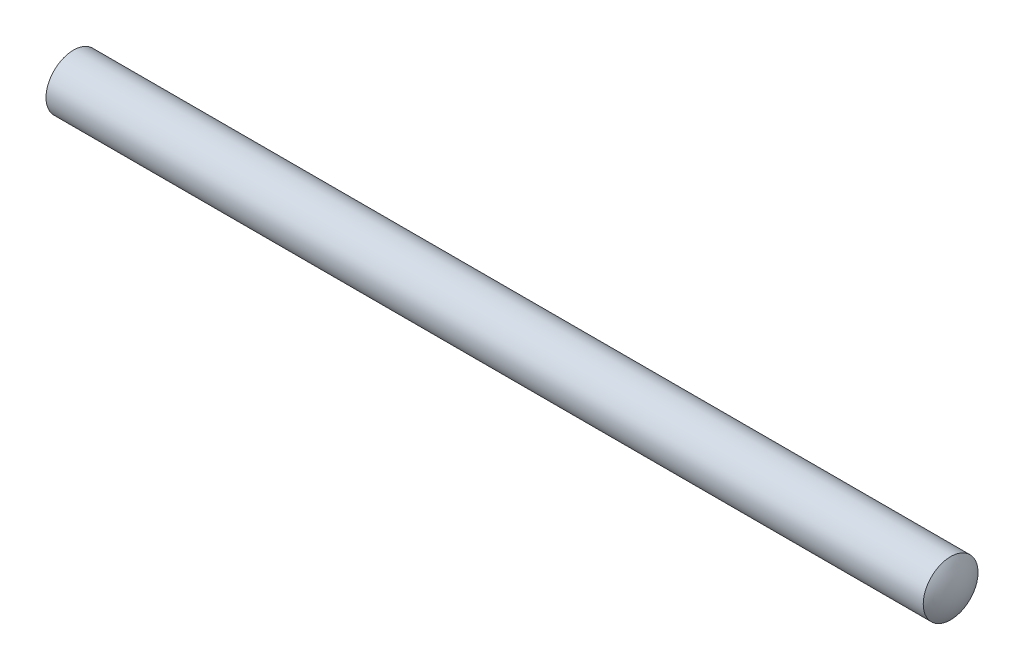
from build123d import *

# Parameters (mm, degrees)
BOSS_EXTRUDE1_DEPTH      = 38.1
BOSS_EXTRUDE1_DEPTH_BACK = 38.1
SKETCH1_R                = 2.38125


with BuildPart() as part:
    # Sketch1 → Boss-Extrude1 (new, two sides: drawn at the far end of the back side and taken through both)
    with BuildSketch(Plane(origin=(0, 0, 0), x_dir=(0, 0, -1), z_dir=(1, 0, 0)).offset(-BOSS_EXTRUDE1_DEPTH_BACK)):
        with Locations(Location((0, 0, 0), (0, 0, 180))):
            Circle(SKETCH1_R)
    extrude(amount=BOSS_EXTRUDE1_DEPTH + BOSS_EXTRUDE1_DEPTH_BACK)

    # Sketch2 → Revolve2 (revolve)
    with BuildSketch(Plane(origin=(0, 0, 0), x_dir=(1, 0, 0), z_dir=(0, 1, 0))):
        with BuildLine():
            Line((38.1, 0), (38.1, -2.38125))
            ThreePointArc((38.1, -2.38125), (38.690086839, -1.255028946), (38.89375, 0))
            Line((38.89375, 0), (38.1, 0))
        make_face()
    revolve(axis=Axis((38.1, 0, 0), (1, 0, 0)))


solid = part.part
